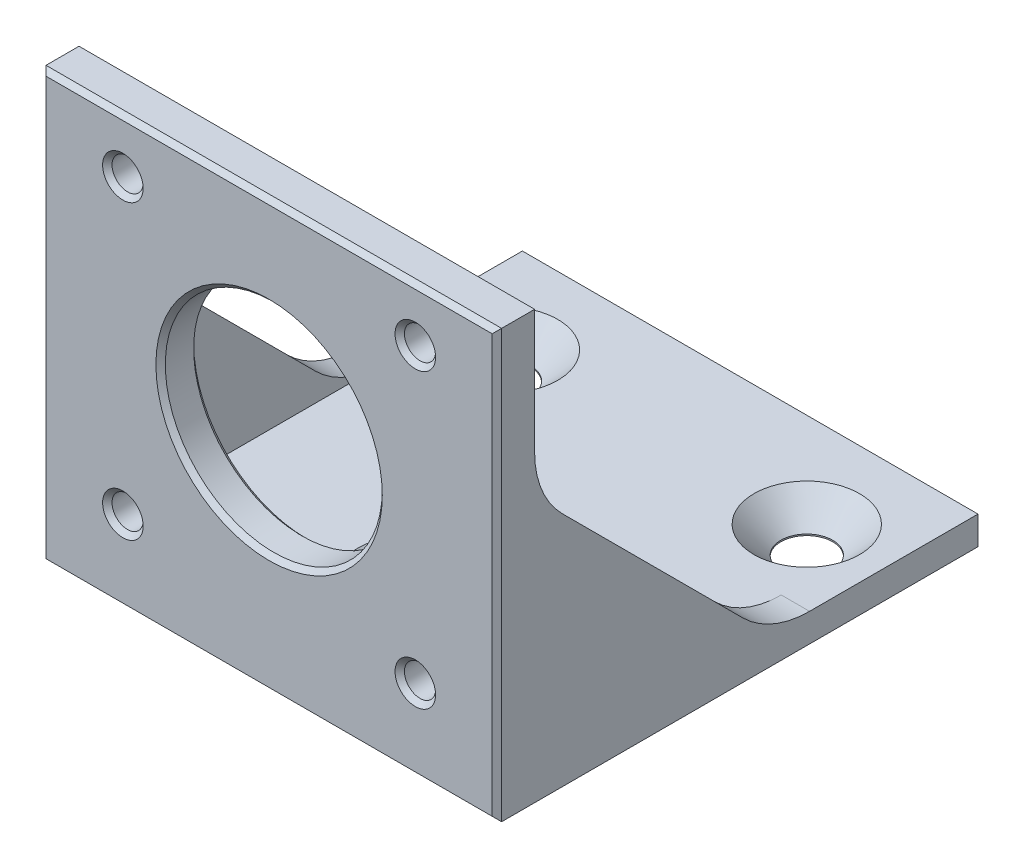
from build123d import *

# Parameters (mm, degrees)
ESQUISSE1_W                                = 48.3
ESQUISSE1_H                                = 42.3
ESQUISSE1_R                                = 11.5
ESQUISSE1_R_2                              = 1.65
BOSS_EXTRU_1_DEPTH                         = 4
ESQUISSE2_W                                = 48.3
ESQUISSE2_H                                = 51
BOSS_EXTRU_2_DEPTH                         = 3
BOSS_EXTRU_3_DEPTH                         = 3
CONG_1_R                                   = 10
CHANFREIN1_SIZE                            = 0.5
CHANFREIN2_SIZE                            = 0.5
FRAISAGE_POUR_VIS_T_TE_FRAIS_E_BOM_2_COUNT = 2
FRAISAGE_POUR_VIS_T_TE_FRAIS_E_BOM_2_PITCH = 30.528675045
FRAISAGE_POUR_VIS_T_TE_FRAIS_E_BOM_3_COUNT = 2
FRAISAGE_POUR_VIS_T_TE_FRAIS_E_BOM_3_PITCH = 30.528675045


with BuildPart() as part:
    # Esquisse1 → Boss.-Extru.1 (new body)
    with BuildSketch(Plane.XY):
        Rectangle(ESQUISSE1_W, ESQUISSE1_H)
        Circle(ESQUISSE1_R, mode=Mode.SUBTRACT)
        with Locations((-15.5, 15.5)):
            Circle(ESQUISSE1_R_2, mode=Mode.SUBTRACT)
        with Locations((15.5, 15.5)):
            Circle(ESQUISSE1_R_2, mode=Mode.SUBTRACT)
        with Locations((15.5, -15.5)):
            Circle(ESQUISSE1_R_2, mode=Mode.SUBTRACT)
        with Locations((-15.5, -15.5)):
            Circle(ESQUISSE1_R_2, mode=Mode.SUBTRACT)
    extrude(amount=BOSS_EXTRU_1_DEPTH)

    # Esquisse2 → Boss.-Extru.2 (add)
    with BuildSketch(Plane.XZ.offset(21.15)):
        with Locations((0, -21.5)):
            Rectangle(ESQUISSE2_W, ESQUISSE2_H)
    extrude(amount=BOSS_EXTRU_2_DEPTH)

    # Esquisse3 → Boss.-Extru.3 (add)
    with BuildSketch(Plane.ZY.offset(24.15)):
        Polygon((0, 3.85), (-25, -21.15), (0, -21.15), align=None)
    boss_extru_3 = extrude(amount=-BOSS_EXTRU_3_DEPTH)

    # Symétrie1: Boss.-Extru.3 across plane
    add(boss_extru_3.mirror(Plane(origin=(0, 0, 0), x_dir=(0, 0, 1), z_dir=(1, 0, 0))))

    # Congé1
    cong_1_edges = [part.edges().sort_by_distance(p)[0] for p in [
        (-22.65, 3.85, 0),
        (-22.65, -21.15, -25),
        (22.65, 3.85, 0),
        (22.65, -21.15, -25),
    ]]
    fillet(cong_1_edges, radius=CONG_1_R)

    # Chanfrein1
    chanfrein1_edges = [part.edges().sort_by_distance(p)[0] for p in [
        (-11.5, 0, 4),
        (24.15, -1.5, 4),
        (-17.15, 15.5, 4),
        (0, 21.15, 4),
        (13.85, 15.5, 4),
        (13.85, -15.5, 4),
        (-17.15, -15.5, 4),
        (0, -24.15, 4),
        (-24.15, -1.5, 4),
    ]]
    chamfer(chanfrein1_edges, length=CHANFREIN1_SIZE)

    # Chanfrein2
    chanfrein2_edges = [part.edges().sort_by_distance(p)[0] for p in [
        (-11.5, 0, 0),
    ]]
    chamfer(chanfrein2_edges, length=CHANFREIN2_SIZE)

    # Esquisse4 → Fraisage pour vis à tête fraisée bombée fendue M51 (revolve, cut)
    with BuildSketch(Plane(origin=(0, -21.15, -11), x_dir=(0, 0, 1), z_dir=(1, 0, 0))):
        Polygon((0, 0), (0, 3), (2.75, 3), (2.75, 2.85), (5.6, 0), align=None)
    fraisage_pour_vis_t_te_frais_e_bomb_e = revolve(axis=Axis((0, -14.8, -11), (0, -1, 0)), mode=Mode.SUBTRACT)

    # Fraisage pour vis _ t_te frais_e bom 2: Fraisage pour vis à tête fraisée bombée fendue M51 ×2
    with Locations(*[Vector(0.5240974256643348, 0, -0.8516583167045438) * (i * FRAISAGE_POUR_VIS_T_TE_FRAIS_E_BOM_2_PITCH) for i in range(1, FRAISAGE_POUR_VIS_T_TE_FRAIS_E_BOM_2_COUNT)]):
        add(fraisage_pour_vis_t_te_frais_e_bomb_e, mode=Mode.SUBTRACT)

    # Fraisage pour vis _ t_te frais_e bom 3: Fraisage pour vis à tête fraisée bombée fendue M51 ×2
    with Locations(*[Vector(-0.5240974256643347, 0, -0.851658316704544) * (i * FRAISAGE_POUR_VIS_T_TE_FRAIS_E_BOM_3_PITCH) for i in range(1, FRAISAGE_POUR_VIS_T_TE_FRAIS_E_BOM_3_COUNT)]):
        add(fraisage_pour_vis_t_te_frais_e_bomb_e, mode=Mode.SUBTRACT)


solid = part.part
